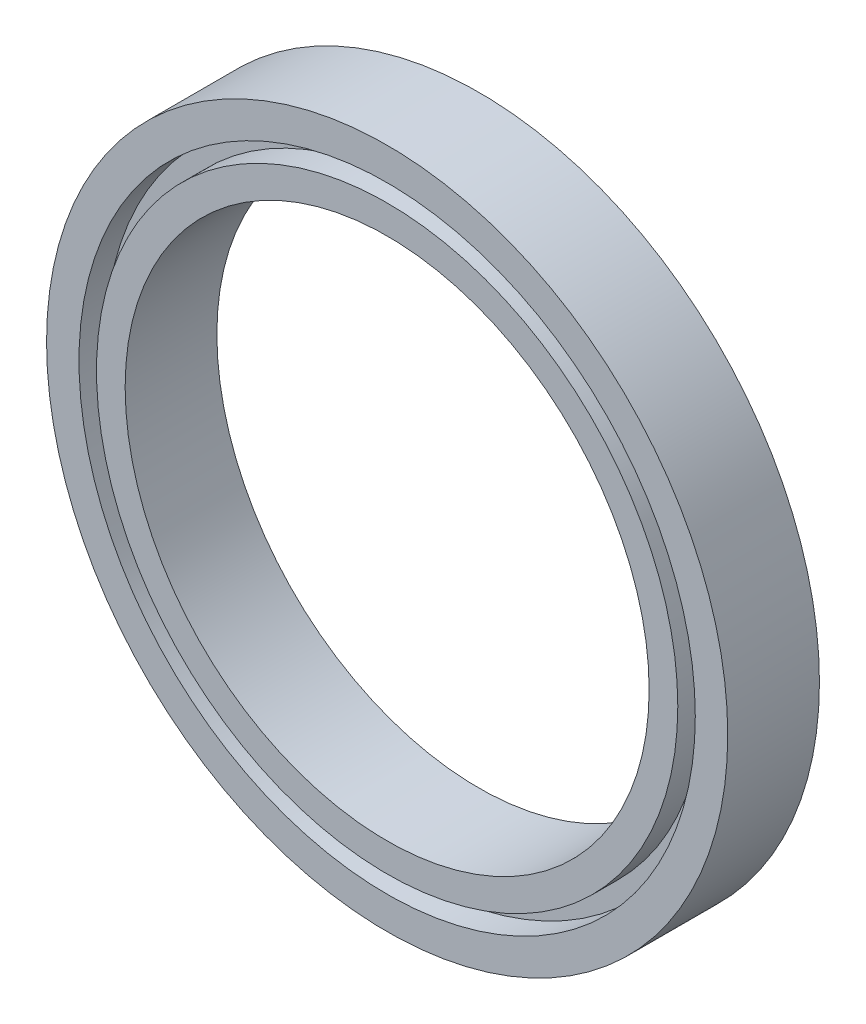
from build123d import *

# Parameters (mm, degrees)
SKETCH_1_R          = 26
SKETCH_1_R_2        = 20
EXTRUDE_1_DEPTH     = 3.5
SKETCH_2_R          = 23.523275985
SKETCH_2_R_2        = 22.187065931
CUT_EXTRUDE_3_DEPTH = 2


with BuildPart() as part:
    # 草图1 → 凸台-拉伸1 (new, symmetric)
    with BuildSketch(Plane.XY):
        Circle(SKETCH_1_R)
        Circle(SKETCH_1_R_2, mode=Mode.SUBTRACT)
    extrude(amount=EXTRUDE_1_DEPTH, both=True)

    # 草图2 → 切除-拉伸3 (cut)
    with BuildSketch(Plane.XY.offset(3.5)):
        Circle(SKETCH_2_R)
        Circle(SKETCH_2_R_2, mode=Mode.SUBTRACT)
    extrude(amount=-CUT_EXTRUDE_3_DEPTH, mode=Mode.SUBTRACT)


solid = part.part
